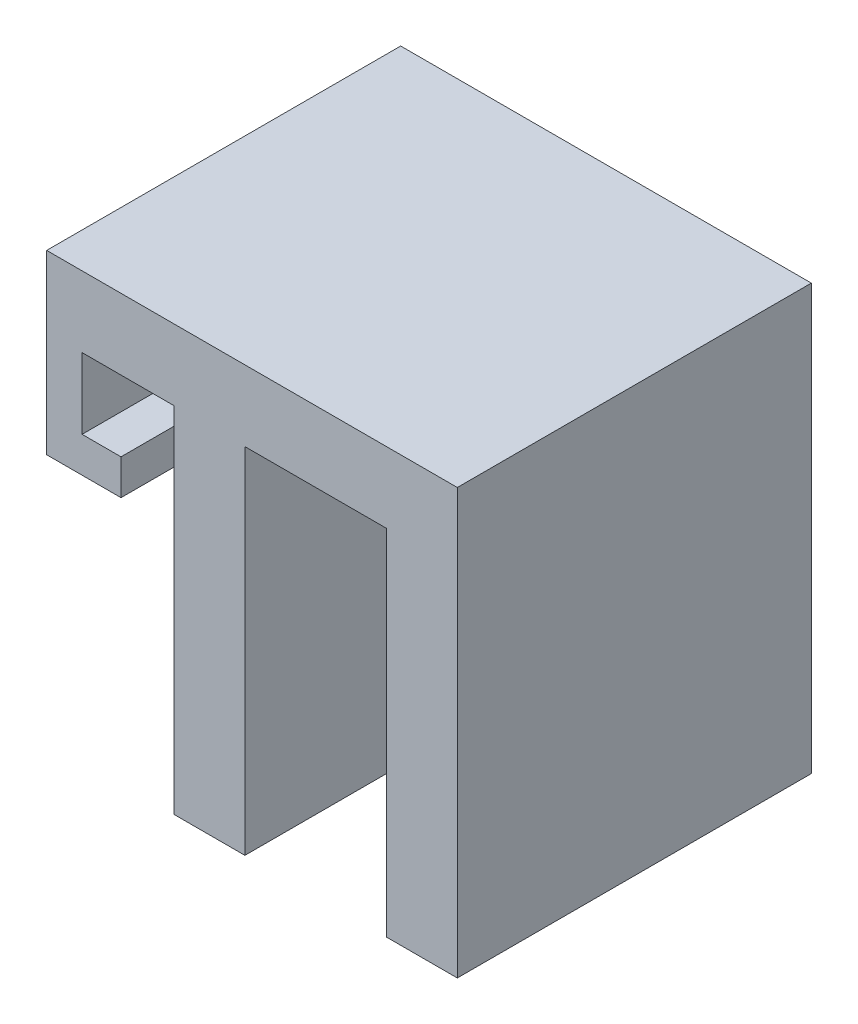
from build123d import *

# Parameters (mm, degrees)
BOSS_EXTRUDE1_DEPTH = 10


with BuildPart() as part:
    # Sketch1 → Boss-Extrude1 (new body)
    with BuildSketch(Plane.XY):
        Polygon((-4, -10), (-4, 0), (0, 0), (0, -10), (2, -10), (2, 2), (-5, 2), (-8, 2), (-9.6, 2), (-9.6, -3), (-7.5, -3), (-7.5, -2), (-8.6, -2), (-8.6, 0), (-7, 0), (-6, 0), (-6, -10), align=None)
    extrude(amount=BOSS_EXTRUDE1_DEPTH)


solid = part.part
